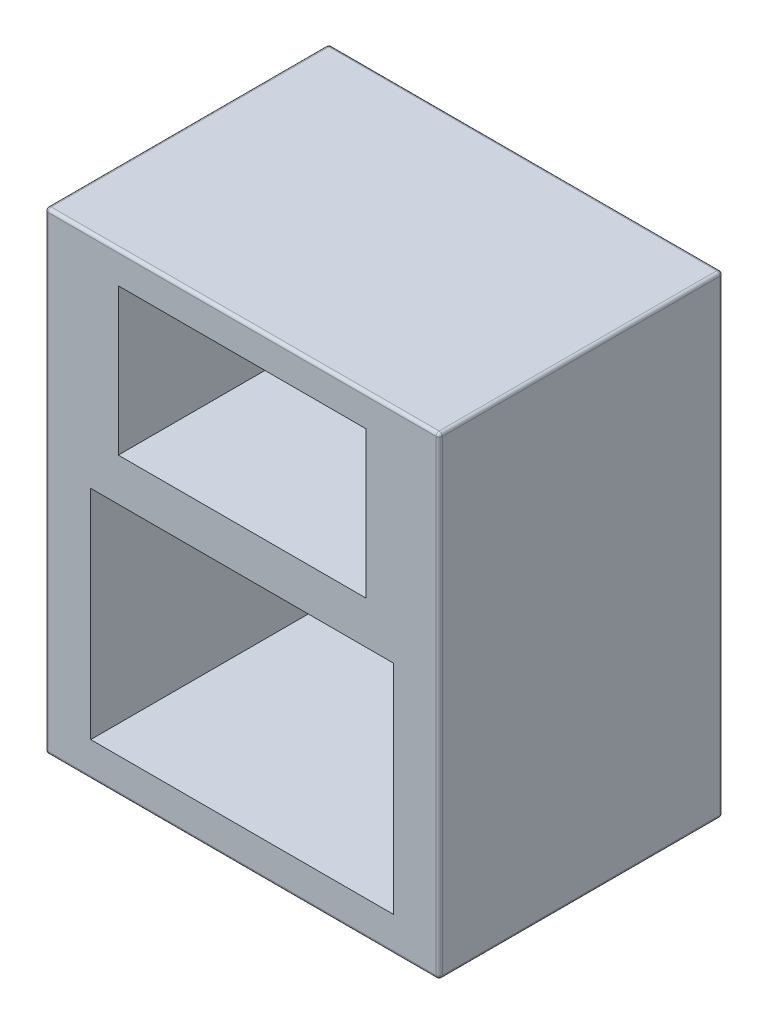
from build123d import *

# Parameters (mm, degrees)
SKETCH_1_W          = 250
SKETCH_1_H          = 300
EXTRUDE_1_DEPTH     = 180
FILLET_1_R          = 2
CUT_EXTRUDE_1_REACH = 432
SKETCH_2_W          = 157
SKETCH_2_H          = 93
SKETCH_2_W_2        = 192
SKETCH_2_H_2        = 138


with BuildPart() as part:
    # 草图1 → 凸台-拉伸1 (new body)
    with BuildSketch(Plane.XY):
        with Locations((125, 150)):
            Rectangle(SKETCH_1_W, SKETCH_1_H)
    extrude(amount=EXTRUDE_1_DEPTH)

    # 圆角1
    fillet_1_edges = [part.edges().sort_by_distance(p)[0] for p in [
        (250, 150, 180),
        (125, 300, 180),
        (0, 150, 180),
        (125, 300, 0),
        (250, 150, 0),
        (125, 0, 0),
        (0, 150, 0),
        (125, 0, 180),
        (0, 300, 90),
        (250, 300, 90),
        (250, 0, 90),
        (0, 0, 90),
    ]]
    fillet(fillet_1_edges, radius=FILLET_1_R)

    # 草图2 → 切除-拉伸1 (cut, up to next)
    with BuildSketch(Plane.XY.offset(180), mode=Mode.PRIVATE) as cut_extrude_1_sk1:
        with Locations((125, 233.5)):
            Rectangle(SKETCH_2_W, SKETCH_2_H)
    cut_extrude_1_tool1 = extrude(cut_extrude_1_sk1.sketch, amount=-CUT_EXTRUDE_1_REACH, mode=Mode.PRIVATE) & part.part
    # 草图2 → 切除-拉伸1 (cut, up to next)
    with BuildSketch(Plane.XY.offset(180), mode=Mode.PRIVATE) as cut_extrude_1_sk2:
        with Locations((125, 91)):
            Rectangle(SKETCH_2_W_2, SKETCH_2_H_2)
    cut_extrude_1_tool2 = extrude(cut_extrude_1_sk2.sketch, amount=-CUT_EXTRUDE_1_REACH, mode=Mode.PRIVATE) & part.part
    add(cut_extrude_1_tool1.solids().sort_by_distance((125, 233.5, 180))[0], mode=Mode.SUBTRACT)
    add(cut_extrude_1_tool2.solids().sort_by_distance((125, 91, 180))[0], mode=Mode.SUBTRACT)


solid = part.part
